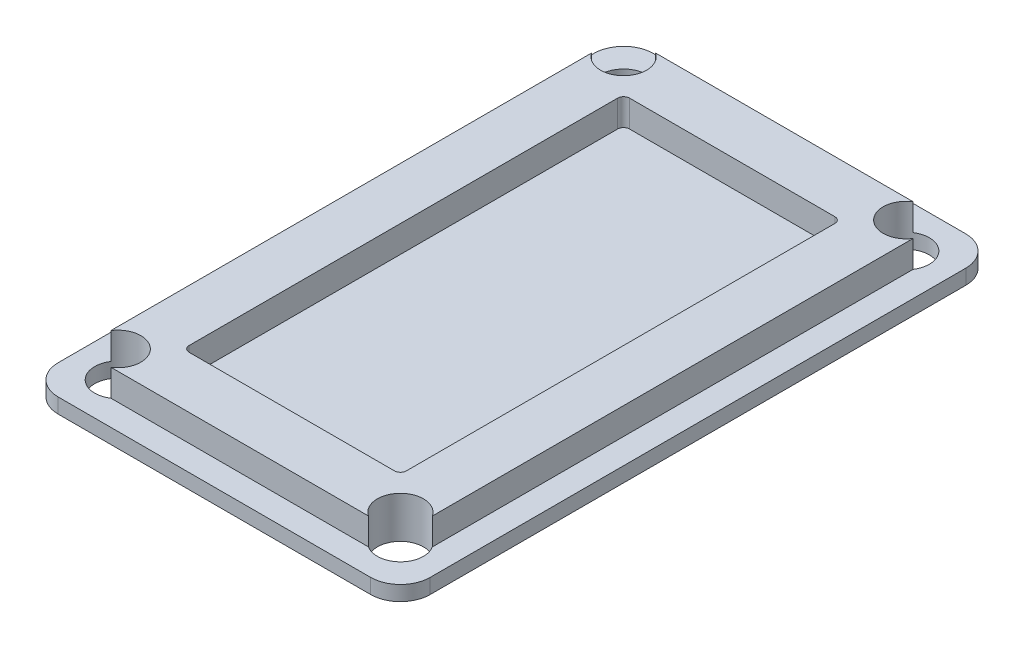
from build123d import *

# Parameters (mm, degrees)
BASE_DEPTH        = 1
INT_RIEUR_DEPTH   = 1.8
PASSAGE_VIS_REACH = 25.751
ESQUISSE4_R       = 1.55
ESQUISSE5_W       = 27.6
ESQUISSE5_H       = 42.6
CLEANING_DEPTH    = 1.8


with BuildPart() as part:
    # Esquisse1 → Base (new body)
    with BuildSketch(Plane(origin=(0, 0, 0), x_dir=(1, 0, 0), z_dir=(0, 1, 0))):
        with BuildLine():
            Line((-10.5, 20), (10.5, 20))
            ThreePointArc((10.5, 20), (11.914213562, 19.414213562), (12.5, 18))
            Line((12.5, 18), (12.5, -18))
            ThreePointArc((12.5, -18), (11.914213562, -19.414213562), (10.5, -20))
            Line((10.5, -20), (-10.5, -20))
            ThreePointArc((-10.5, -20), (-11.914213562, -19.414213562), (-12.5, -18))
            Line((-12.5, -18), (-12.5, 18))
            ThreePointArc((-12.5, 18), (-11.914213562, 19.414213562), (-10.5, 20))
        make_face()
    extrude(amount=BASE_DEPTH)

    # Esquisse2 → Intérieur (add)
    with BuildSketch(Plane(origin=(0, 1, 0), x_dir=(1, 0, 0), z_dir=(0, 1, 0))):
        with BuildLine():
            Line((10.5, 18.3), (-10.5, 18.3))
            ThreePointArc((-10.5, 18.3), (-10.712132034, 18.212132034), (-10.8, 18))
            Line((-10.8, 18), (-10.8, -18))
            ThreePointArc((-10.8, -18), (-10.712132034, -18.212132034), (-10.5, -18.3))
            Line((-10.5, -18.3), (10.5, -18.3))
            ThreePointArc((10.5, -18.3), (10.712132034, -18.212132034), (10.8, -18))
            Line((10.8, -18), (10.8, 18))
            ThreePointArc((10.8, 18), (10.712132034, 18.212132034), (10.5, 18.3))
        make_face()
        with BuildLine():
            Line((-6.9, 14.8), (6.9, 14.8))
            ThreePointArc((6.9, 14.8), (7.182842712, 14.682842712), (7.3, 14.4))
            Line((7.3, 14.4), (7.3, -14.4))
            ThreePointArc((7.3, -14.4), (7.182842712, -14.682842712), (6.9, -14.8))
            Line((6.9, -14.8), (-6.9, -14.8))
            ThreePointArc((-6.9, -14.8), (-7.182842712, -14.682842712), (-7.3, -14.4))
            Line((-7.3, -14.4), (-7.3, 14.4))
            ThreePointArc((-7.3, 14.4), (-7.182842712, 14.682842712), (-6.9, 14.8))
        make_face(mode=Mode.SUBTRACT)
    extrude(amount=INT_RIEUR_DEPTH)

    # Esquisse4 → Passage_Vis (cut, up to next)
    with BuildSketch(Plane.XZ, mode=Mode.PRIVATE) as passage_vis_sk1:
        with Locations(Location((-9.5, 17, 0), (0, 0, 270))):
            Circle(ESQUISSE4_R)
    passage_vis_tool1 = extrude(passage_vis_sk1.sketch, amount=-PASSAGE_VIS_REACH, mode=Mode.PRIVATE) & part.part
    # Esquisse4 → Passage_Vis (cut, up to next)
    with BuildSketch(Plane.XZ, mode=Mode.PRIVATE) as passage_vis_sk2:
        with Locations(Location((9.5, 17, 0), (0, 0, 327.004114526))):
            Circle(ESQUISSE4_R)
    passage_vis_tool2 = extrude(passage_vis_sk2.sketch, amount=-PASSAGE_VIS_REACH, mode=Mode.PRIVATE) & part.part
    # Esquisse4 → Passage_Vis (cut, up to next)
    with BuildSketch(Plane.XZ, mode=Mode.PRIVATE) as passage_vis_sk3:
        with Locations(Location((9.5, -17, 0), (0, 0, 270))):
            Circle(ESQUISSE4_R)
    passage_vis_tool3 = extrude(passage_vis_sk3.sketch, amount=-PASSAGE_VIS_REACH, mode=Mode.PRIVATE) & part.part
    # Esquisse4 → Passage_Vis (cut, up to next)
    with BuildSketch(Plane.XZ, mode=Mode.PRIVATE) as passage_vis_sk4:
        with Locations(Location((-9.5, -17, 0), (0, 0, 237.004114526))):
            Circle(ESQUISSE4_R)
    passage_vis_tool4 = extrude(passage_vis_sk4.sketch, amount=-PASSAGE_VIS_REACH, mode=Mode.PRIVATE) & part.part
    add(passage_vis_tool1.solids().sort_by_distance((-9.5, 0, 17))[0], mode=Mode.SUBTRACT)
    add(passage_vis_tool2.solids().sort_by_distance((9.5, 0, 17))[0], mode=Mode.SUBTRACT)
    add(passage_vis_tool3.solids().sort_by_distance((9.5, 0, -17))[0], mode=Mode.SUBTRACT)
    add(passage_vis_tool4.solids().sort_by_distance((-9.5, 0, -17))[0], mode=Mode.SUBTRACT)

    # Esquisse5 → Cleaning (cut)
    with BuildSketch(Plane(origin=(0, 2.8, 0), x_dir=(1, 0, 0), z_dir=(0, 1, 0))):
        Rectangle(ESQUISSE5_W, ESQUISSE5_H)
        with BuildLine():
            Line((-9.2, 18.3), (9.2, 18.3))
            ThreePointArc((9.2, 18.3), (10.33137085, 17.83137085), (10.8, 16.7))
            Line((10.8, 16.7), (10.8, -16.7))
            ThreePointArc((10.8, -16.7), (10.33137085, -17.83137085), (9.2, -18.3))
            Line((9.2, -18.3), (-9.2, -18.3))
            ThreePointArc((-9.2, -18.3), (-10.33137085, -17.83137085), (-10.8, -16.7))
            Line((-10.8, -16.7), (-10.8, 16.7))
            ThreePointArc((-10.8, 16.7), (-10.33137085, 17.83137085), (-9.2, 18.3))
        make_face(mode=Mode.SUBTRACT)
    extrude(amount=-CLEANING_DEPTH, mode=Mode.SUBTRACT)


solid = part.part
